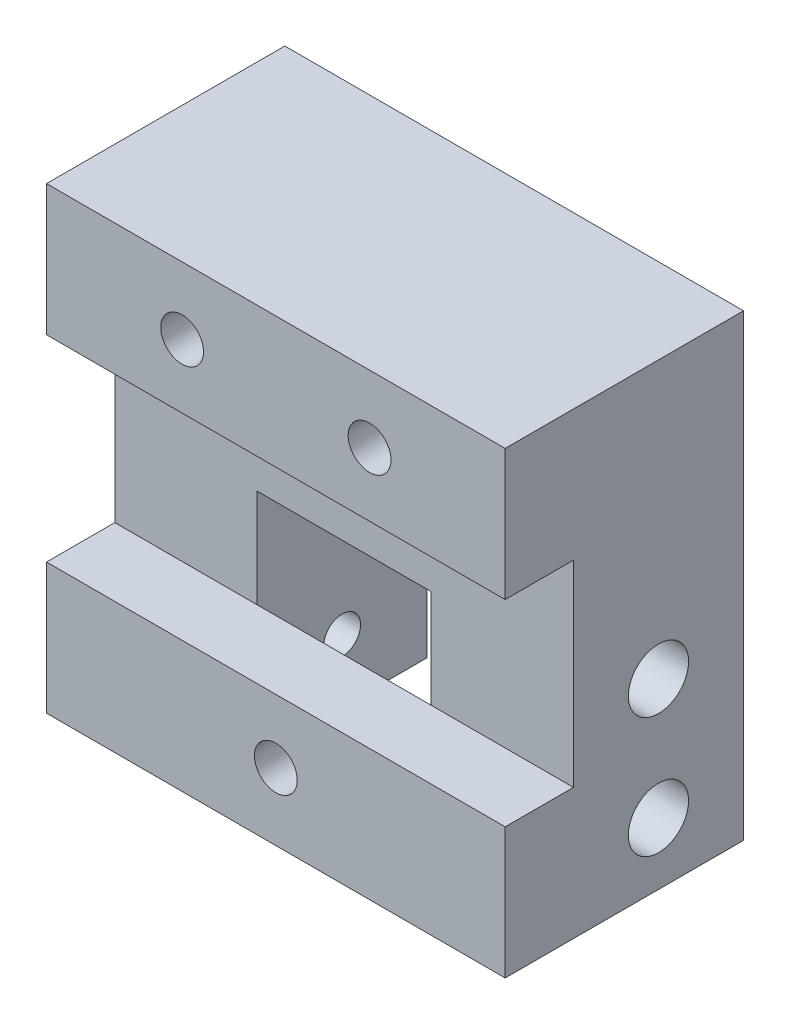
from build123d import *

# Parameters (mm, degrees)
SKETCH1_W               = 68.52
SKETCH1_H               = 68.52
BOSS_EXTRUDE1_DEPTH     = 35.6
SKETCH2_W               = 68.52
SKETCH2_H               = 29.4
CUT_EXTRUDE1_DEPTH      = 10.2
SKETCH3_R               = 3.2
CUT_EXTRUDE2_DEPTH      = 10.2
SKETCH4_W               = 26
SKETCH4_H               = 34.26
CUT_EXTRUDE3_DEPTH      = 25.4
CUT_EXTRUDE4_DEPTH      = 85.47542838
CUT_EXTRUDE4_DEPTH_BACK = 85.47542838
SKETCH6_R               = 2.75
SKETCH7_R               = 4.5
CUT_EXTRUDE5_DEPTH      = 13.26
CUT_EXTRUDE6_START      = -13.26
SKETCH8_R               = 4.5
CUT_EXTRUDE6_DEPTH      = 13.26


with BuildPart() as part:
    # Sketch1 → Boss-Extrude1 (new body)
    with BuildSketch(Plane.XY):
        Rectangle(SKETCH1_W, SKETCH1_H)
    extrude(amount=BOSS_EXTRUDE1_DEPTH)

    # Sketch2 → Cut-Extrude1 (cut)
    with BuildSketch(Plane.XY.offset(35.6)):
        Rectangle(SKETCH2_W, SKETCH2_H)
    extrude(amount=-CUT_EXTRUDE1_DEPTH, mode=Mode.SUBTRACT)

    # Sketch3 → Cut-Extrude2 (cut)
    with BuildSketch(Plane.XY.offset(35.6)):
        with Locations((-14, 24.2141445)):
            Circle(SKETCH3_R)
        with Locations((14, 24.2141445)):
            Circle(SKETCH3_R)
        with Locations((0, -24.2141445)):
            Circle(SKETCH3_R)
    extrude(amount=-CUT_EXTRUDE2_DEPTH, mode=Mode.SUBTRACT)

    # Sketch4 → Cut-Extrude3 (cut)
    with BuildSketch(Plane(origin=(0, 0, 0), x_dir=(-1, 0, 0), z_dir=(0, 0, -1))):
        with Locations((0, -17.13)):
            Rectangle(SKETCH4_W, SKETCH4_H)
    extrude(amount=-CUT_EXTRUDE3_DEPTH, mode=Mode.SUBTRACT)

    # Sketch6 → Cut-Extrude4 (cut, two sides: drawn at the far end of the back side and taken through both)
    with BuildSketch(Plane(origin=(34.26, 0, 0), x_dir=(0, 0, -1), z_dir=(1, 0, 0)).offset(-CUT_EXTRUDE4_DEPTH_BACK)):
        with Locations((-12.7, -7)):
            Circle(SKETCH6_R)
        with Locations((-12.7, -25)):
            Circle(SKETCH6_R)
    extrude(amount=CUT_EXTRUDE4_DEPTH + CUT_EXTRUDE4_DEPTH_BACK, mode=Mode.SUBTRACT)

    # Sketch7 → Cut-Extrude5 (cut)
    with BuildSketch(Plane(origin=(34.26, 0, 0), x_dir=(0, 0, -1), z_dir=(1, 0, 0))):
        with Locations((-12.7, -7)):
            Circle(SKETCH7_R)
        with Locations((-12.7, -25)):
            Circle(SKETCH7_R)
    extrude(amount=-CUT_EXTRUDE5_DEPTH, mode=Mode.SUBTRACT)

    # Sketch8 → Cut-Extrude6 (cut)
    with BuildSketch(Plane.ZY.offset(34.26).offset(CUT_EXTRUDE6_START)):
        with Locations(Location((12.7, -7, 0), (0, 0, 180))):
            Circle(SKETCH8_R)
        with Locations(Location((12.7, -25, 0), (0, 0, 180))):
            Circle(SKETCH8_R)
    extrude(amount=CUT_EXTRUDE6_DEPTH, mode=Mode.SUBTRACT)


solid = part.part
